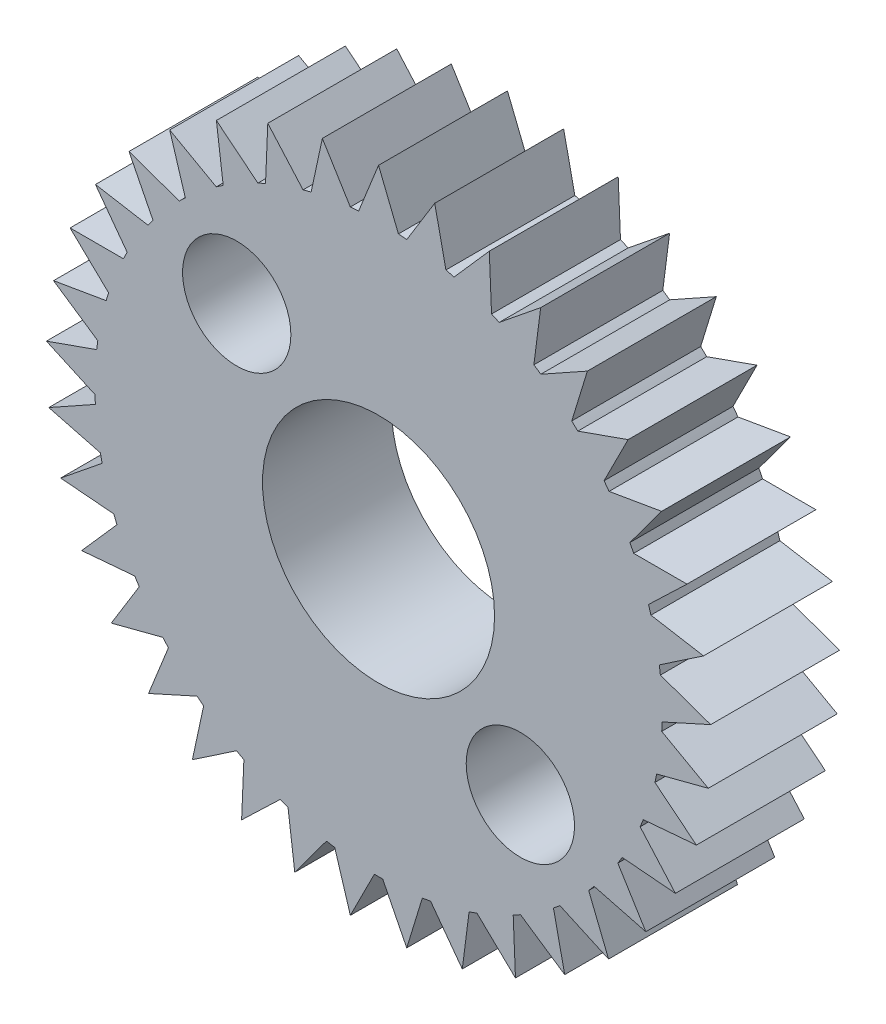
from build123d import *

# Parameters (mm, degrees)
ESQUISSE1_R                  = 11
ESQUISSE1_R_2                = 4.5
ESQUISSE1_R_3                = 2.1
BOSS_EXTRU_1_DEPTH           = 5
BOSS_EXTRU_2_DEPTH           = 5
R_P_TITION_CIRCULAIRE1_COUNT = 37


with BuildPart() as part:
    # Esquisse1 → Boss.-Extru.1 (new body)
    with BuildSketch(Plane.XY):
        Circle(ESQUISSE1_R)
        Circle(ESQUISSE1_R_2, mode=Mode.SUBTRACT)
        with Locations((-5.5, 5.5)):
            Circle(ESQUISSE1_R_3, mode=Mode.SUBTRACT)
        with Locations(Location((5.5, -5.5, 0), (0, 0, 180))):
            Circle(ESQUISSE1_R_3, mode=Mode.SUBTRACT)
    extrude(amount=BOSS_EXTRU_1_DEPTH)

    # Esquisse2 → Boss.-Extru.2 (add)
    with BuildSketch(Plane.XY.offset(5)):
        Polygon((0, 12.892709197), (-0.883743736, 10.692594879), (0.883743736, 10.692594879), align=None)
    boss_extru_2 = extrude(amount=-BOSS_EXTRU_2_DEPTH)

    # Répétition circulaire1: Boss.-Extru.2 ×37 about axis
    r_p_tition_circulaire1_axis = Axis((0, 0, 0), (0, 0, 1))
    for i in range(1, R_P_TITION_CIRCULAIRE1_COUNT):
        add(boss_extru_2.rotate(r_p_tition_circulaire1_axis, i * 360 / R_P_TITION_CIRCULAIRE1_COUNT))


solid = part.part
